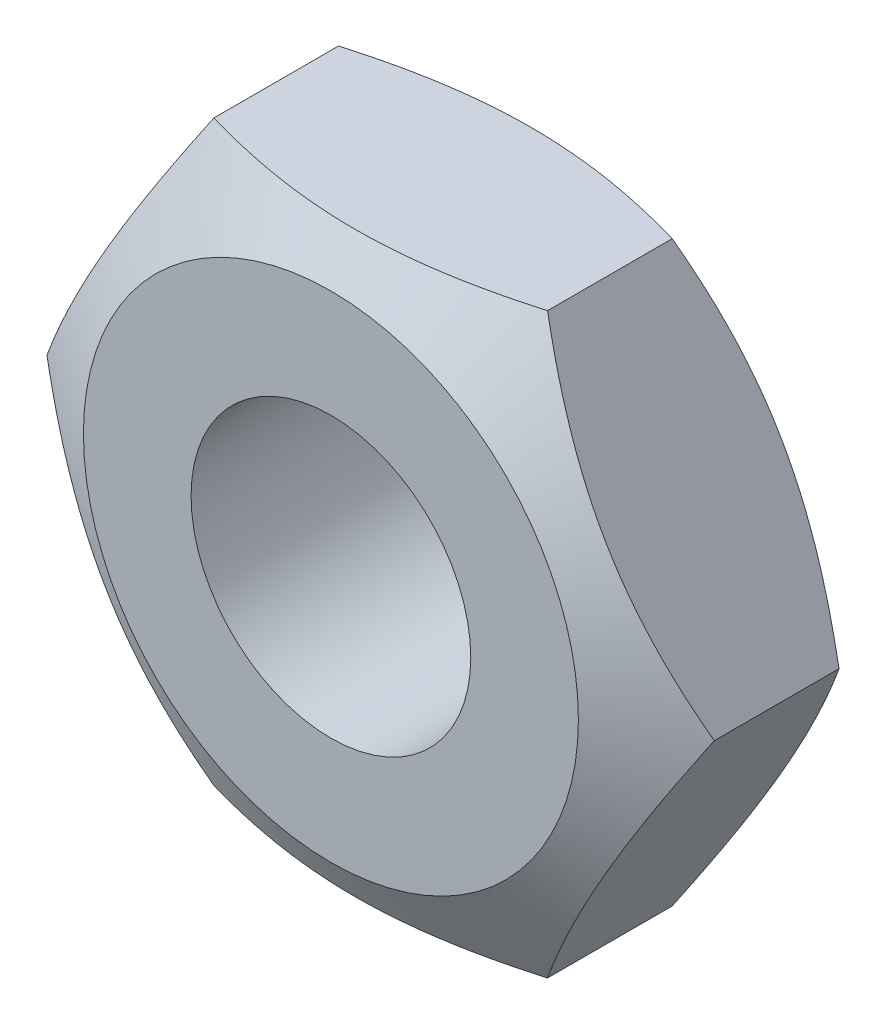
from build123d import *

# Parameters (mm, degrees)
BOSS_EXTRUDE1_DEPTH          = 5.5372
SKETCH6_OUTSIDE_W            = 68.81
SKETCH6_OUTSIDE_H            = 66.602
SKETCH6_OUTSIDE_R            = 6.112735428
CUT_EXTRUDE4_DEPTH           = 13.228781918
CUT_EXTRUDE4_DRAFT           = -60
MIRROR1_COPY_1_SKETCH_W      = 68.81
MIRROR1_COPY_1_SKETCH_H      = 66.602
MIRROR1_COPY_1_SKETCH_R      = 6.112735428
MIRROR1_COPY_1_DEPTH         = 13.228781918
MIRROR1_COPY_1_DRAFT         = -60
F_5_16_24_TAPPED_HOLE2_D     = 6.9088
F_5_16_24_TAPPED_HOLE2_DEPTH = 21.336
F_5_16_24_TAPPED_HOLE2_TIP   = 2.075612922


with BuildPart() as part:
    # Sketch1 → Boss-Extrude1 (new body)
    with BuildSketch(Plane.XY):
        Polygon((4.121592226, 7.1374), (-4.120373604, 7.138103572), (-8.24196583, 0.000703572), (-4.121592226, -7.1374), (4.120373604, -7.138103572), (8.24196583, -0.000703572), align=None)
    extrude(amount=BOSS_EXTRUDE1_DEPTH)


with BuildPart() as cut_extrude4_tool:
    # Sketch6 outside → Cut-Extrude4 (with draft: the straight prism first)
    with BuildSketch(Plane(origin=(0, 0, 0), x_dir=(-1, 0, 0), z_dir=(0, 0, -1))):
        Rectangle(SKETCH6_OUTSIDE_W, SKETCH6_OUTSIDE_H)
        Circle(SKETCH6_OUTSIDE_R, mode=Mode.SUBTRACT)
    extrude(amount=-CUT_EXTRUDE4_DEPTH)
    # Cut-Extrude4: the draft: its side faces are tilted about the plane it starts from
    cut_extrude4_sides = [cut_extrude4_tool.faces().sort_by_distance(p)[0] for p in [
        (0, -33.301, 6.614390959),
        (-34.405, 0, 6.614390959),
        (0, 33.301, 6.614390959),
        (34.405, 0, 6.614390959),
        (6.112735428, 0, 6.614390959),
    ]]
    draft(cut_extrude4_sides, Plane(origin=(0, 0, 0), x_dir=(-1, 0, 0), z_dir=(0, 0, -1)), CUT_EXTRUDE4_DRAFT)


with BuildPart() as part_1:
    add(part.part)

    # Cut-Extrude4: cut by cut_extrude4_tool
    add(cut_extrude4_tool.part, mode=Mode.SUBTRACT)


with BuildPart() as mirror1_copy_1_tool:
    # Mirror1 copy 1 sketch → Mirror1 copy 1 (with draft: the straight prism first)
    with BuildSketch(Plane(origin=(0, 0, 5.5372), x_dir=(-1, 0, 0), z_dir=(0, 0, 1))):
        Rectangle(MIRROR1_COPY_1_SKETCH_W, MIRROR1_COPY_1_SKETCH_H)
        Circle(MIRROR1_COPY_1_SKETCH_R, mode=Mode.SUBTRACT)
    extrude(amount=-MIRROR1_COPY_1_DEPTH)
    # Mirror1 copy 1: the draft: its side faces are tilted about the plane it starts from
    mirror1_copy_1_sides = [mirror1_copy_1_tool.faces().sort_by_distance(p)[0] for p in [
        (0, -33.301, -1.077190959),
        (-34.405, 0, -1.077190959),
        (0, 33.301, -1.077190959),
        (34.405, 0, -1.077190959),
        (6.112735428, 0, -1.077190959),
    ]]
    draft(mirror1_copy_1_sides, Plane(origin=(0, 0, 5.5372), x_dir=(-1, 0, 0), z_dir=(0, 0, 1)), MIRROR1_COPY_1_DRAFT)


with BuildPart() as part_2:
    add(part_1.part)

    # Mirror1 copy 1: cut by mirror1_copy_1_tool
    add(mirror1_copy_1_tool.part, mode=Mode.SUBTRACT)

    # 5/16-24 Tapped Hole2
    with Locations(Plane.XY.offset(5.5372)):
        with Locations((0, 0)):
            Hole(F_5_16_24_TAPPED_HOLE2_D / 2, depth=F_5_16_24_TAPPED_HOLE2_DEPTH)
            with Locations((0, 0, -(F_5_16_24_TAPPED_HOLE2_DEPTH + F_5_16_24_TAPPED_HOLE2_TIP / 2))):  # 118° drill point
                Cone(0, F_5_16_24_TAPPED_HOLE2_D / 2, F_5_16_24_TAPPED_HOLE2_TIP, mode=Mode.SUBTRACT)


solid = part_2.part
